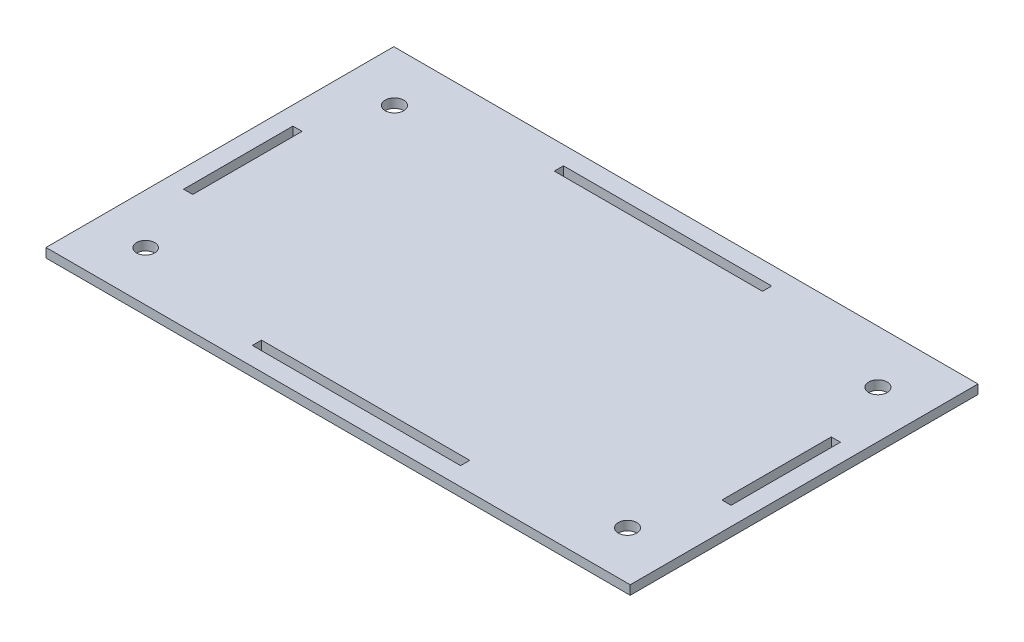
from build123d import *

# Parameters (mm, degrees)
SKETCH2_W           = 127.41
SKETCH2_H           = 75.848
SKETCH2_R           = 1.975434392
SKETCH2_R_2         = 2.02059866
SKETCH2_R_3         = 2.005784304
SKETCH2_R_4         = 2.007647525
SKETCH2_W_2         = 2
SKETCH2_H_2         = 23.848
SKETCH2_W_3         = 45.41
SKETCH2_H_3         = 2
BOSS_EXTRUDE1_DEPTH = 2


with BuildPart() as part:
    # Sketch2 → Boss-Extrude1 (new body)
    with BuildSketch(Plane(origin=(0, 0, 0), x_dir=(1, 0, 0), z_dir=(0, 1, 0))):
        with Locations((56.48154317, 30.702122774)):
            Rectangle(SKETCH2_W, SKETCH2_H)
        with Locations(Location((3.695346689, 3.585176853, 0), (0, 0, 270))):
            Circle(SKETCH2_R, mode=Mode.SUBTRACT)
        with Locations(Location((3.945209928, 57.606557407, 0), (0, 0, 270))):
            Circle(SKETCH2_R_2, mode=Mode.SUBTRACT)
        with Locations(Location((109.903070514, 57.08563935, 0), (0, 0, 270))):
            Circle(SKETCH2_R_3, mode=Mode.SUBTRACT)
        with Locations(Location((109.140500171, 3.238215507, 0), (0, 0, 270))):
            Circle(SKETCH2_R_4, mode=Mode.SUBTRACT)
        with Locations((-2.22345683, 30.702122774)):
            Rectangle(SKETCH2_W_2, SKETCH2_H_2, mode=Mode.SUBTRACT)
        with Locations((56.48154317, 63.626122774)):
            Rectangle(SKETCH2_W_3, SKETCH2_H_3, mode=Mode.SUBTRACT)
        with Locations((115.18654317, 30.702122774)):
            Rectangle(SKETCH2_W_2, SKETCH2_H_2, mode=Mode.SUBTRACT)
        with Locations((56.48154317, -2.221877226)):
            Rectangle(SKETCH2_W_3, SKETCH2_H_3, mode=Mode.SUBTRACT)
    extrude(amount=BOSS_EXTRUDE1_DEPTH)


solid = part.part
